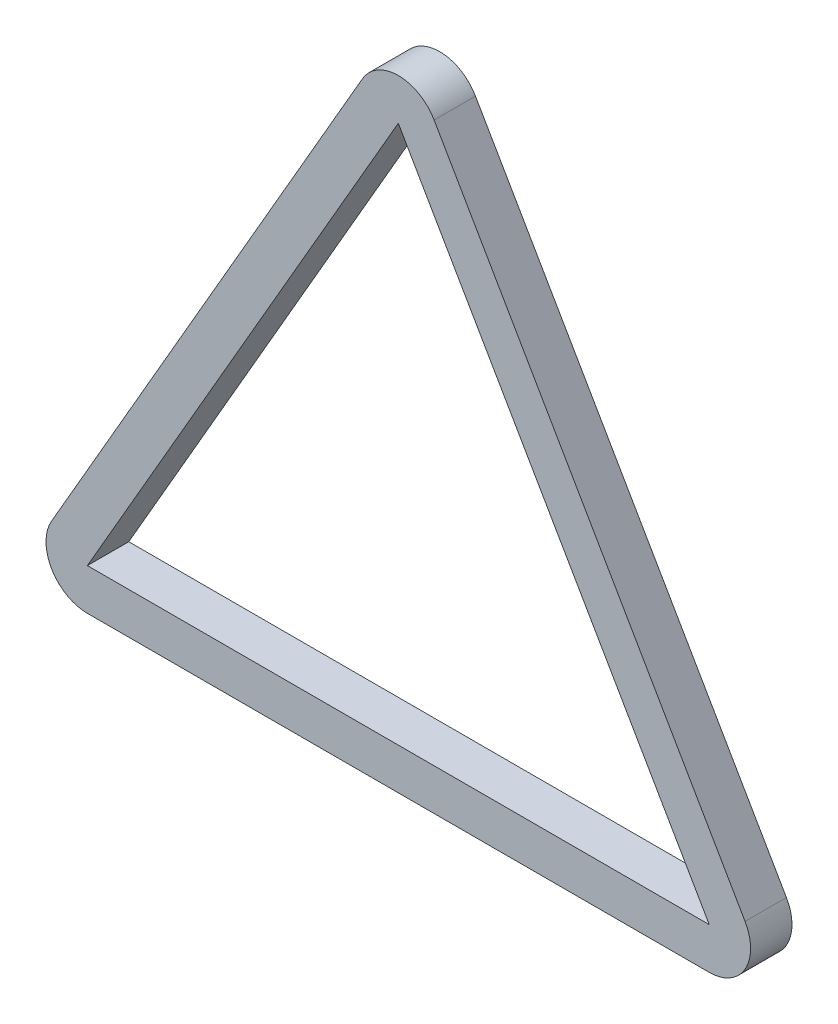
from build123d import *

# Parameters (mm, degrees)
EXTRUDE_1_DEPTH = 20
FILLET_1_R      = 20


with BuildPart() as part:
    # 草圖1 → 填料-伸長1 (new body)
    with BuildSketch(Plane.XY):
        Polygon((0, 179.483059357), (-185, -140.946340043), (185, -140.946340043), align=None)
        Polygon((0, 139.483059357), (-150.358983849, -120.946340043), (150.358983849, -120.946340043), align=None, mode=Mode.SUBTRACT)
    extrude(amount=EXTRUDE_1_DEPTH)

    # 圓角1
    fillet_1_edges = [part.edges().sort_by_distance(p)[0] for p in [
        (185, -140.946340043, 10),
        (-185, -140.946340043, 10),
        (0, 179.483059357, 10),
    ]]
    fillet(fillet_1_edges, radius=FILLET_1_R)


solid = part.part
